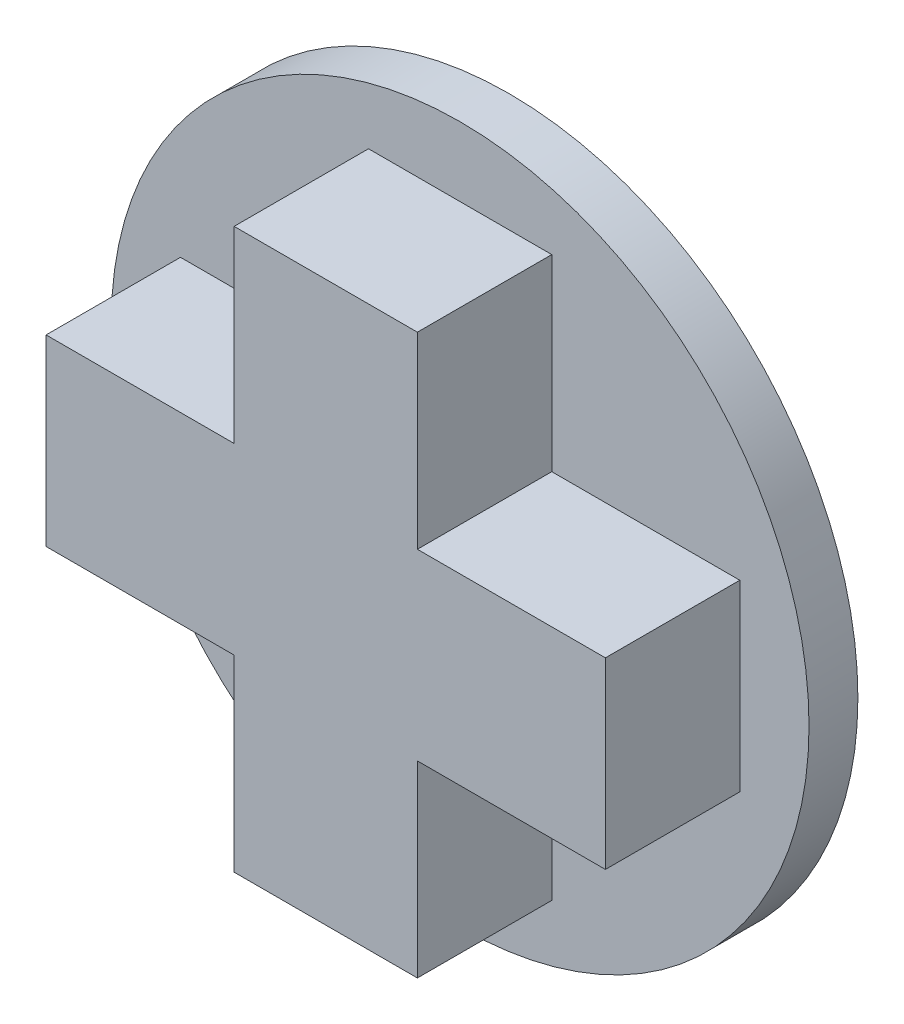
from build123d import *

# Parameters (mm, degrees)
SKETCH1_R           = 12.85
BOSS_EXTRUDE1_DEPTH = 1.8
BOSS_EXTRUDE2_DEPTH = 4.95
SKETCH3_R           = 2.65
BOSS_EXTRUDE3_DEPTH = 2.5
FILLET1_R           = 1.25


with BuildPart() as part:
    # Sketch1 → Boss-Extrude1 (new body)
    with BuildSketch(Plane.XY):
        Circle(SKETCH1_R)
    extrude(amount=BOSS_EXTRUDE1_DEPTH)

    # Sketch2 → Boss-Extrude2 (add)
    with BuildSketch(Plane.XY.offset(1.8)):
        Polygon((3.375, 3.375), (10.3, 3.375), (10.3, -3.375), (3.375, -3.375), (3.375, -10.3), (-3.375, -10.3), (-3.375, -3.375), (-10.3, -3.375), (-10.3, 3.375), (-3.375, 3.375), (-3.375, 10.3), (3.375, 10.3), align=None)
    extrude(amount=BOSS_EXTRUDE2_DEPTH)

    # Sketch3 → Boss-Extrude3 (add)
    with BuildSketch(Plane(origin=(0, 0, 0), x_dir=(-1, 0, 0), z_dir=(0, 0, -1))):
        with Locations(Location((0, 0, 0), (0, 0, 180))):
            Circle(SKETCH3_R)
    extrude(amount=BOSS_EXTRUDE3_DEPTH)

    # Fillet1
    fillet1_edges = [part.edges().sort_by_distance(p)[0] for p in [
        (-2.65, 0, -2.5),
    ]]
    fillet(fillet1_edges, radius=FILLET1_R)


solid = part.part
